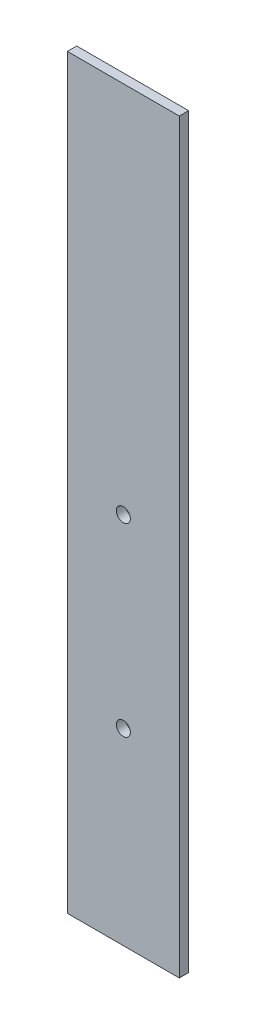
from build123d import *

# Parameters (mm, degrees)
SKETCH1_W           = 38.1
SKETCH1_H           = 254
SKETCH1_R           = 2.38125
BOSS_EXTRUDE1_DEPTH = 3.175


with BuildPart() as part:
    # Sketch1 → Boss-Extrude1 (new body)
    with BuildSketch(Plane.XY):
        with Locations((19.05, -127)):
            Rectangle(SKETCH1_W, SKETCH1_H)
        with Locations((19.05, -127)):
            Circle(SKETCH1_R, mode=Mode.SUBTRACT)
        with Locations((19.05, -189.971009211)):
            Circle(SKETCH1_R, mode=Mode.SUBTRACT)
    extrude(amount=BOSS_EXTRUDE1_DEPTH)


solid = part.part
